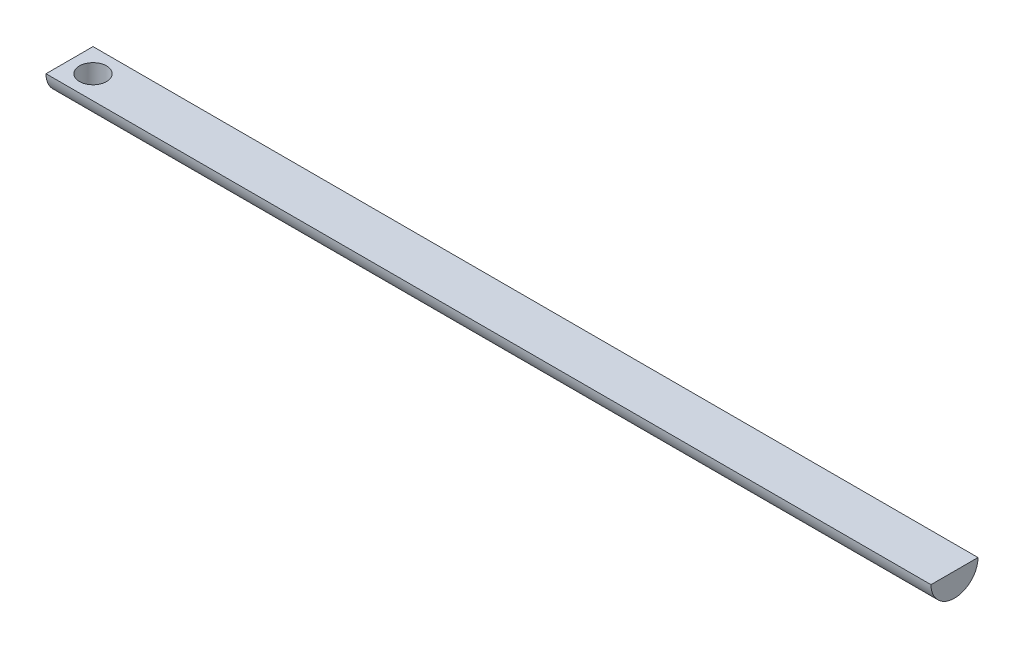
from build123d import *

# Parameters (mm, degrees)
BOSS_EXTRUDE1_DEPTH      = 160
BOSS_EXTRUDE1_DEPTH_BACK = 19.238381132
M5_CLEARANCE_HOLE1_D     = 5.5
M5_CLEARANCE_HOLE1_DEPTH = 12.7
M5_CLEARANCE_HOLE1_TIP   = 1.652366702


with BuildPart() as part:
    # Sketch1 → Boss-Extrude1 (new, two sides: drawn at the far end of the back side and taken through both)
    with BuildSketch(Plane(origin=(0, 0, 0), x_dir=(0, 0, -1), z_dir=(1, 0, 0)).offset(-BOSS_EXTRUDE1_DEPTH_BACK)):
        with BuildLine():
            Line((-4.7625, 0), (4.7625, 0))
            ThreePointArc((4.7625, 0), (0, -4.7625), (-4.7625, 0))
        make_face()
    extrude(amount=BOSS_EXTRUDE1_DEPTH + BOSS_EXTRUDE1_DEPTH_BACK)

    # M5 Clearance Hole1
    with Locations(Plane(origin=(0, 0, 0), x_dir=(1, 0, 0), z_dir=(0, 1, 0))):
        with Locations((-14.475881132, 0)):
            Hole(M5_CLEARANCE_HOLE1_D / 2, depth=M5_CLEARANCE_HOLE1_DEPTH)
            with Locations((0, 0, -(M5_CLEARANCE_HOLE1_DEPTH + M5_CLEARANCE_HOLE1_TIP / 2))):  # 118° drill point
                Cone(0, M5_CLEARANCE_HOLE1_D / 2, M5_CLEARANCE_HOLE1_TIP, mode=Mode.SUBTRACT)


solid = part.part
